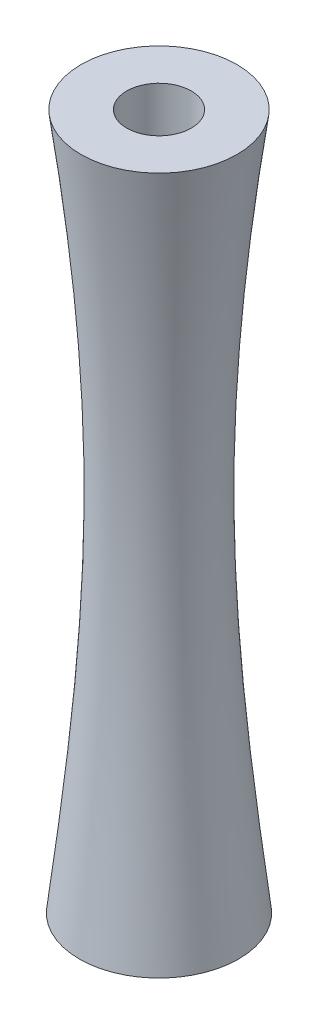
from build123d import *

# Parameters (mm, degrees)
SKETCH4_R          = 2.999994
CUT_EXTRUDE1_DEPTH = 66.580528249


with BuildPart() as part:
    # Sketch3 → Revolve1 (revolve)
    with BuildSketch(Plane.XY):
        with BuildLine():
            Line((0, 31.891215803), (-7.252142088, 31.891215803))
            add(Edge.make_bspline(
                [(-7.252142088, 31.891215803), (-3.660429743, 6.118144213), (-4.660429627, -9.914658108), (-7.40952314, -32.846745264)],
                knots=[0, 0, 0, 0, 1, 1, 1, 1], degree=3))
            Line((-7.40952314, -32.846745264), (0, -32.846745264))
            Line((0, -32.846745264), (0, 31.891215803))
        make_face()
    revolve(axis=Axis((0, 31.891215803, 0), (0, -1, 0)))

    # Sketch4 → Cut-Extrude1 (cut, through all)
    with BuildSketch(Plane(origin=(0, 31.891215803, 0), x_dir=(1, 0, 0), z_dir=(0, 1, 0))):
        with Locations(Location((0, 0, 0), (0, 0, 180))):
            Circle(SKETCH4_R)
    extrude(amount=-CUT_EXTRUDE1_DEPTH, mode=Mode.SUBTRACT)


solid = part.part
